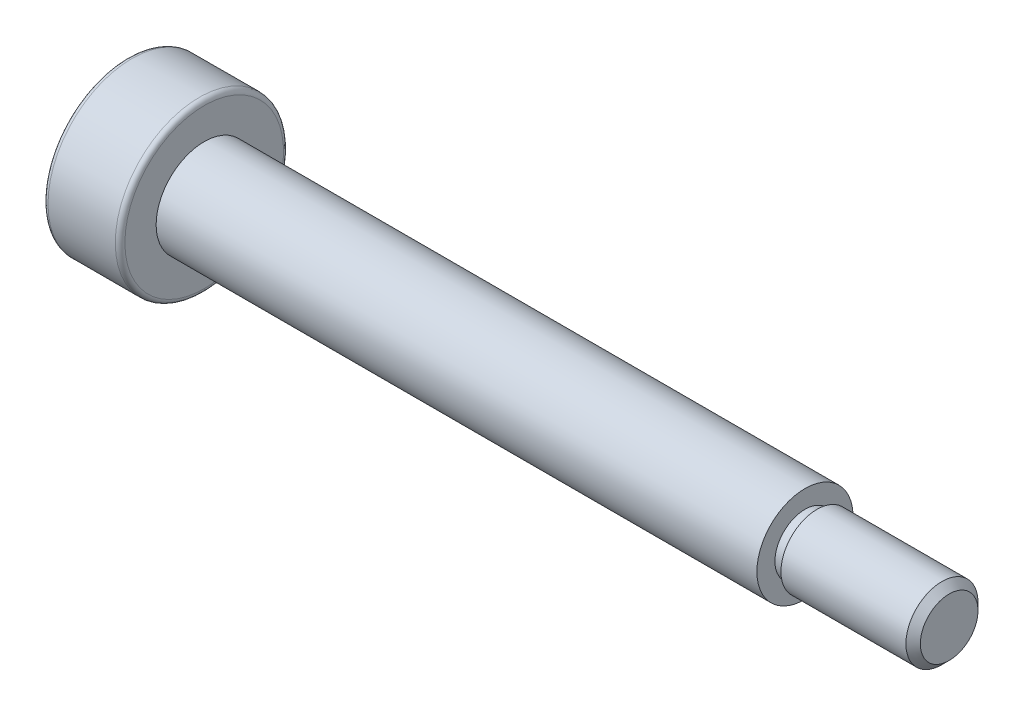
from build123d import *

# Parameters (mm, degrees)
FILLET_1_R          = 0.2
CHAMFER_1_SIZE      = 0.3
SKETCH_3_W          = 0.5
SKETCH_3_H          = 0.25
CUT_EXTRUDE_1_DEPTH = 2


with BuildPart() as part:
    # 草图1 → 旋转1 (revolve)
    with BuildSketch(Plane.XY, mode=Mode.PRIVATE) as revolve_1_sk:
        Polygon((-17.1, 0), (-17.1, 3.5), (-13.9, 3.5), (-13.9, 2), (11.1, 2), (11.1, 1.5), (17.1, 1.5), (17.1, 0), align=None)
    revolve(revolve_1_sk.sketch.rotate(Axis((-17.1, 0, 0), (1, 0, 0)), 90), axis=Axis((-17.1, 0, 0), (1, 0, 0)))

    # 圆角1
    fillet_1_edges = [part.edges().sort_by_distance(p)[0] for p in [
        (-13.9, 0, -3.5),
        (-17.1, 0, -3.5),
    ]]
    fillet(fillet_1_edges, radius=FILLET_1_R)

    # 倒角1
    chamfer_1_edges = [part.edges().sort_by_distance(p)[0] for p in [
        (17.1, 0, -1.5),
    ]]
    chamfer(chamfer_1_edges, length=CHAMFER_1_SIZE)

    # 草图3 → 切除-旋转1 (revolve, cut)
    with BuildSketch(Plane.XY, mode=Mode.PRIVATE) as cut_revolve_1_sk:
        with Locations((11.35, 1.375)):
            Rectangle(SKETCH_3_W, SKETCH_3_H)
    revolve(cut_revolve_1_sk.sketch.rotate(Axis((11.1, 0, 0), (1, 0, 0)), 90), axis=Axis((11.1, 0, 0), (1, 0, 0)), mode=Mode.SUBTRACT)

    # 草图4 → 切除-拉伸1 (cut)
    with BuildSketch(Plane.ZY.offset(17.1)):
        Polygon((1.732050808, 0), (0.866025404, 1.5), (-0.866025404, 1.5), (-1.732050808, 0), (-0.866025404, -1.5), (0.866025404, -1.5), align=None)
    extrude(amount=-CUT_EXTRUDE_1_DEPTH, mode=Mode.SUBTRACT)


solid = part.part
